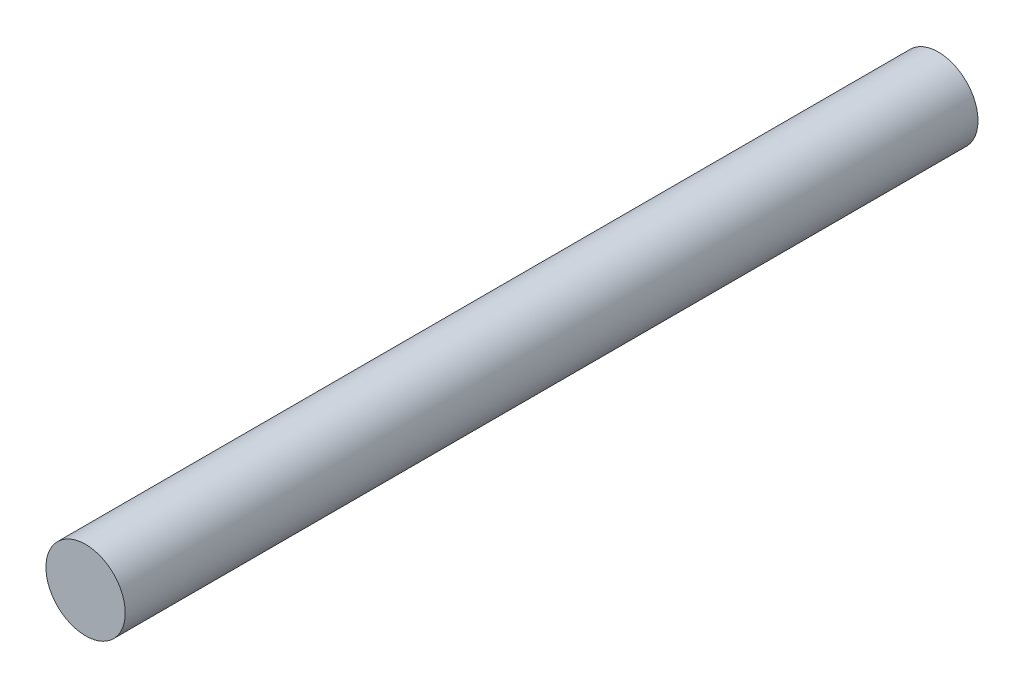
from build123d import *

# Parameters (mm, degrees)
SKETCH1_R           = 2
BOSS_EXTRUDE1_DEPTH = 43


with BuildPart() as part:
    # Sketch1 → Boss-Extrude1 (new body)
    with BuildSketch(Plane.XY):
        Circle(SKETCH1_R)
    extrude(amount=BOSS_EXTRUDE1_DEPTH)


solid = part.part
